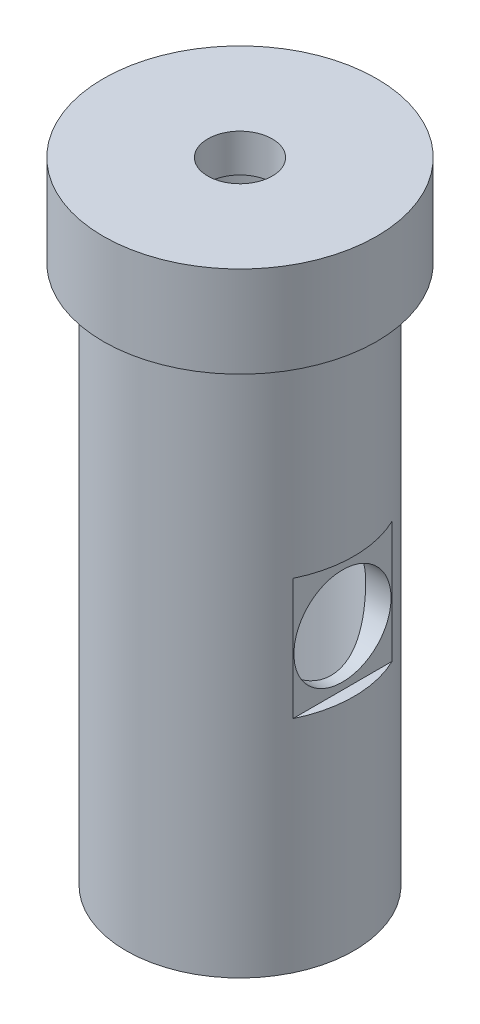
from build123d import *

# Parameters (mm, degrees)
TAGLIO_ESTRUSIONE1_START = 15
SCHIZZO2_W               = 16
SCHIZZO2_H               = 16
TAGLIO_ESTRUSIONE1_DEPTH = 1.5
FORO_12_8_12_8_1_D       = 12.8
FORO_12_8_12_8_1_DEPTH   = 15.154492038
FORO_12_8_12_8_1_TIP     = 3.845507962


with BuildPart() as part:
    # Schizzo1 → Rivoluzione1 (revolve)
    with BuildSketch(Plane.XY, mode=Mode.PRIVATE) as rivoluzione1_sk:
        Polygon((-12, 0), (-15, 0), (-15, 71), (-18, 71), (-18, 83), (-4.25, 83), (-4.25, 78), (-12, 78), align=None)
    revolve(rivoluzione1_sk.sketch.rotate(Axis((0, 0, 0), (0, 1, 0)), 270), axis=Axis((0, 0, 0), (0, 1, 0)))

    # Schizzo2 → Taglio-Estrusione1 (cut)
    with BuildSketch(Plane(origin=(0, 0, 0), x_dir=(0, 0, -1), z_dir=(1, 0, 0)).offset(TAGLIO_ESTRUSIONE1_START)):
        with Locations((0, 37)):
            Rectangle(SCHIZZO2_W, SCHIZZO2_H)
    extrude(amount=-TAGLIO_ESTRUSIONE1_DEPTH, mode=Mode.SUBTRACT)

    # Foro Ø12.8 (12.8)-1
    with Locations(Plane(origin=(13.5, 0, 0), x_dir=(0, 0, -1), z_dir=(1, 0, 0))):
        with Locations((0, 36.304872912)):
            Hole(FORO_12_8_12_8_1_D / 2, depth=FORO_12_8_12_8_1_DEPTH)
            with Locations((0, 0, -(FORO_12_8_12_8_1_DEPTH + FORO_12_8_12_8_1_TIP / 2))):  # 118° drill point
                Cone(0, FORO_12_8_12_8_1_D / 2, FORO_12_8_12_8_1_TIP, mode=Mode.SUBTRACT)


solid = part.part
